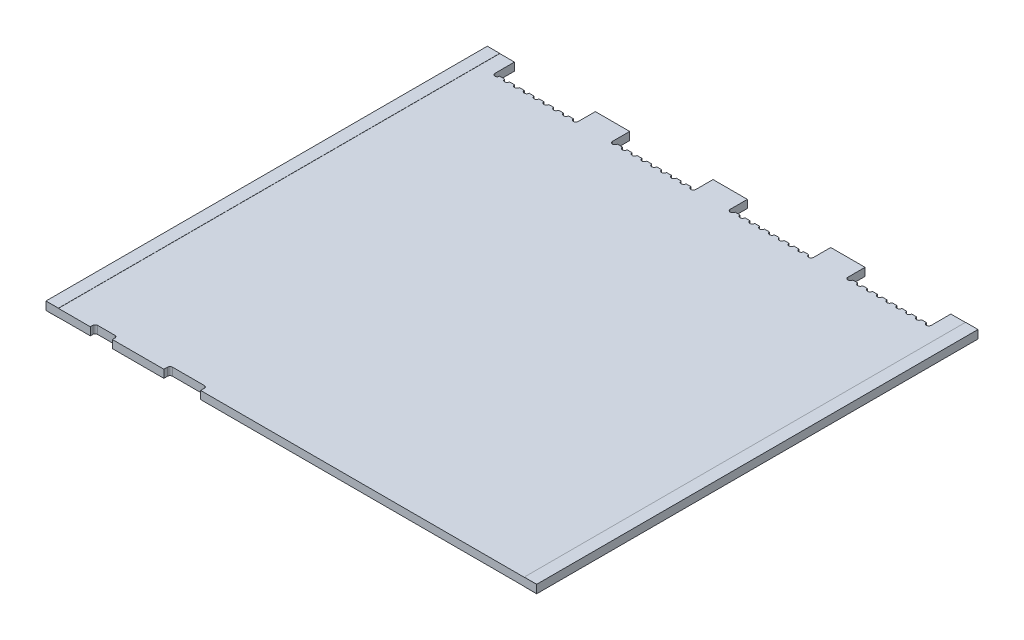
from build123d import *

# Parameters (mm, degrees)
FR4_DEPTH            = 1.61544
GOLD_PLATING_DEPTH   = 90
GOLD_PLATING_2_DEPTH = 90


with BuildPart() as part:
    # Sketch1 → FR4 (new body)
    with BuildSketch(Plane(origin=(0, 0, 0), x_dir=(1, 0, 0), z_dir=(0, 1, 0))):
        with BuildLine():
            Line((0, 90), (5.5, 90))
            Line((5.5, 90), (5.5, 86))
            ThreePointArc((5.5, 86), (6, 85.5), (6.5, 86))
            Line((6.5, 86), (7.5, 86))
            ThreePointArc((7.5, 86), (8, 85.5), (8.5, 86))
            Line((8.5, 86), (9.5, 86))
            ThreePointArc((9.5, 86), (10, 85.5), (10.5, 86))
            Line((10.5, 86), (11.5, 86))
            ThreePointArc((11.5, 86), (12, 85.5), (12.5, 86))
            Line((12.5, 86), (13.5, 86))
            ThreePointArc((13.5, 86), (14, 85.5), (14.5, 86))
            Line((14.5, 86), (15.5, 86))
            ThreePointArc((15.5, 86), (16, 85.5), (16.5, 86))
            Line((16.5, 86), (17.5, 86))
            ThreePointArc((17.5, 86), (18, 85.5), (18.5, 86))
            Line((18.5, 86), (19.5, 86))
            ThreePointArc((19.5, 86), (20, 85.5), (20.5, 86))
            Line((20.5, 86), (21.5, 86))
            ThreePointArc((21.5, 86), (22, 85.5), (22.5, 86))
            Line((22.5, 86), (22.5, 89.5))
            Line((22.5, 89.5), (29.5, 89.5))
            Line((29.5, 89.5), (29.5, 86))
            ThreePointArc((29.5, 86), (30, 85.5), (30.5, 86))
            Line((30.5, 86), (31.5, 86))
            ThreePointArc((31.5, 86), (32, 85.5), (32.5, 86))
            Line((32.5, 86), (33.5, 86))
            ThreePointArc((33.5, 86), (34, 85.5), (34.5, 86))
            Line((34.5, 86), (35.5, 86))
            ThreePointArc((35.5, 86), (36, 85.5), (36.5, 86))
            Line((36.5, 86), (37.5, 86))
            ThreePointArc((37.5, 86), (38, 85.5), (38.5, 86))
            Line((38.5, 86), (39.5, 86))
            ThreePointArc((39.5, 86), (40, 85.5), (40.5, 86))
            Line((40.5, 86), (41.5, 86))
            ThreePointArc((41.5, 86), (42, 85.5), (42.5, 86))
            Line((42.5, 86), (43.5, 86))
            ThreePointArc((43.5, 86), (44, 85.5), (44.5, 86))
            Line((44.5, 86), (45.5, 86))
            ThreePointArc((45.5, 86), (46, 85.5), (46.5, 86))
            Line((46.5, 86), (46.5, 89.5))
            Line((46.5, 89.5), (53.5, 89.5))
            Line((53.5, 89.5), (53.5, 86))
            ThreePointArc((53.5, 86), (54, 85.5), (54.5, 86))
            Line((54.5, 86), (55.5, 86))
            ThreePointArc((55.5, 86), (56, 85.5), (56.5, 86))
            Line((56.5, 86), (57.5, 86))
            ThreePointArc((57.5, 86), (58, 85.5), (58.5, 86))
            Line((58.5, 86), (59.5, 86))
            ThreePointArc((59.5, 86), (60, 85.5), (60.5, 86))
            Line((60.5, 86), (61.5, 86))
            ThreePointArc((61.5, 86), (62, 85.5), (62.5, 86))
            Line((62.5, 86), (63.5, 86))
            ThreePointArc((63.5, 86), (64, 85.5), (64.5, 86))
            Line((64.5, 86), (65.5, 86))
            ThreePointArc((65.5, 86), (66, 85.5), (66.5, 86))
            Line((66.5, 86), (67.5, 86))
            ThreePointArc((67.5, 86), (68, 85.5), (68.5, 86))
            Line((68.5, 86), (69.5, 86))
            ThreePointArc((69.5, 86), (70, 85.5), (70.5, 86))
            Line((70.5, 86), (70.5, 89.5))
            Line((70.5, 89.5), (77.5, 89.5))
            Line((77.5, 89.5), (77.5, 86))
            ThreePointArc((77.5, 86), (78, 85.5), (78.5, 86))
            Line((78.5, 86), (79.5, 86))
            ThreePointArc((79.5, 86), (80, 85.5), (80.5, 86))
            Line((80.5, 86), (81.5, 86))
            ThreePointArc((81.5, 86), (82, 85.5), (82.5, 86))
            Line((82.5, 86), (83.5, 86))
            ThreePointArc((83.5, 86), (84, 85.5), (84.5, 86))
            Line((84.5, 86), (85.5, 86))
            ThreePointArc((85.5, 86), (86, 85.5), (86.5, 86))
            Line((86.5, 86), (87.5, 86))
            ThreePointArc((87.5, 86), (88, 85.5), (88.5, 86))
            Line((88.5, 86), (89.5, 86))
            ThreePointArc((89.5, 86), (90, 85.5), (90.5, 86))
            Line((90.5, 86), (91.5, 86))
            ThreePointArc((91.5, 86), (92, 85.5), (92.5, 86))
            Line((92.5, 86), (93.5, 86))
            ThreePointArc((93.5, 86), (94, 85.5), (94.5, 86))
            Line((94.5, 86), (94.5, 90))
            Line((94.5, 90), (100, 90))
            Line((100, 90), (100, 0))
            Line((100, 0), (31.5, 0))
            Line((31.5, 0), (31.5, 0.75))
            ThreePointArc((31.5, 0.75), (31.353553391, 1.103553391), (31, 1.25))
            Line((31, 1.25), (24.5, 1.25))
            ThreePointArc((24.5, 1.25), (24.146446609, 1.103553391), (24, 0.75))
            Line((24, 0.75), (24, 0))
            Line((24, 0), (13.5, 0))
            Line((13.5, 0), (13.5, 0.4375))
            ThreePointArc((13.5, 0.4375), (13.377432717, 0.832023526), (13, 1))
            Line((13, 1), (9.5, 1))
            ThreePointArc((9.5, 1), (9.146446609, 0.853553391), (9, 0.5))
            Line((9, 0.5), (9, 0))
            Line((9, 0), (0, 0))
            Line((0, 0), (0, 90))
        make_face()
    extrude(amount=FR4_DEPTH)


with BuildPart() as body_2:
    # Sketch2 → gold-plating (new, through all)
    with BuildSketch(Plane.XY):
        Polygon((2.5, 1.61544), (2.5, 1.651), (-0.03556, 1.651), (-0.03556, -0.03556), (2.5, -0.03556), (2.5, 0), (0, 0), (0, 1.61544), align=None)
    extrude(amount=-GOLD_PLATING_DEPTH)


with BuildPart() as body_3:
    # Sketch2 → gold-plating 2 (new, through all)
    with BuildSketch(Plane.XY):
        Polygon((100, 1.61544), (100, 0), (97.5, 0), (97.5, -0.03556), (100.03556, -0.03556), (100.03556, 1.651), (97.5, 1.651), (97.5, 1.61544), align=None)
    extrude(amount=-GOLD_PLATING_2_DEPTH)


solid = Compound([part.part, body_2.part, body_3.part])
